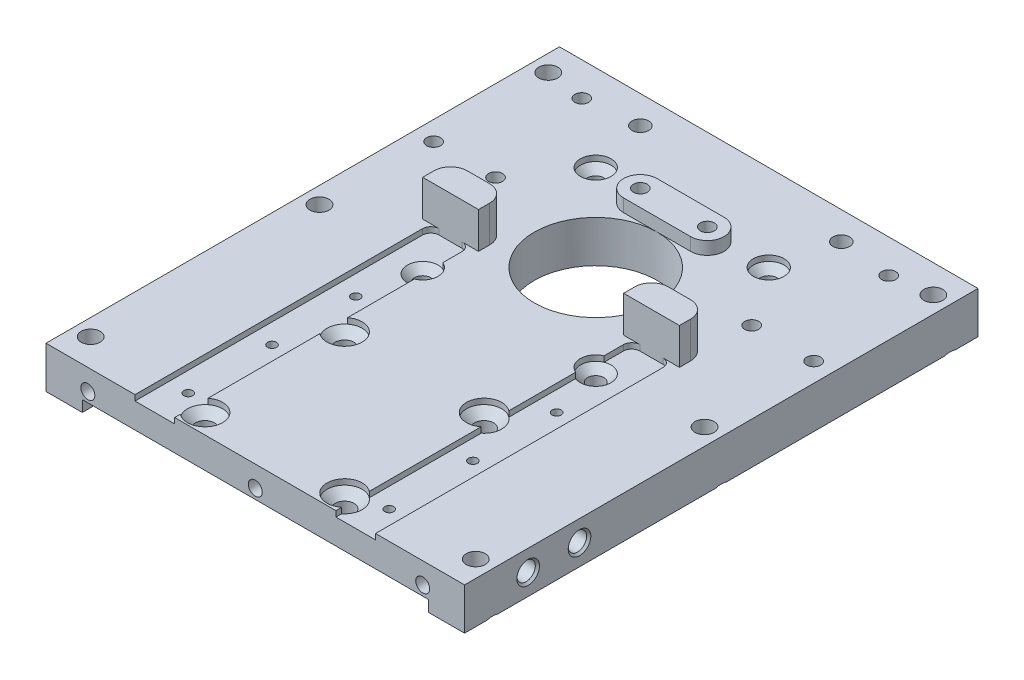
from build123d import *

# Parameters (mm, degrees)
SKETCH_1_W                   = 75
SKETCH_1_H                   = 92
EXTRUDE_1488_DEPTH           = 7.5
SKETCH_16_W                  = 7.1
SKETCH_16_H                  = 53
CUT_EXTRUDE_2987_DEPTH       = 1
HOLE_WIZARD_M3_D             = 1.6
HOLE_WIZARD_15_M3_AT_2_COUNT = 2
HOLE_WIZARD_15_M3_AT_2_PITCH = 25
HOLE_WIZARD_15_M3_AT_3_COUNT = 2
HOLE_WIZARD_15_M3_AT_3_PITCH = 35.355339059
HOLE_WIZARD_15_M3_AT_4_COUNT = 2
HOLE_WIZARD_15_M3_AT_4_PITCH = 25
SKETCH_28_R                  = 11
CUT_EXTRUDE_6514_DEPTH       = 81.64428064
HOLE_WIZARD_6682_AT_2_COUNT  = 2
HOLE_WIZARD_6682_AT_2_PITCH  = 31
HOLE_WIZARD_6682_AT_3_COUNT  = 2
HOLE_WIZARD_6682_AT_3_PITCH  = 43.840620434
HOLE_WIZARD_6682_AT_4_COUNT  = 2
HOLE_WIZARD_6682_AT_4_PITCH  = 31
SKETCH_90_W                  = 10
SKETCH_90_H                  = 5
EXTRUDE_8536_DEPTH           = 6.5
EXTRUDE_9344_DEPTH           = 2.3
HOLE_WIZARD_M3_2_D           = 2.5
SKETCH_77_W                  = 62
SKETCH_77_H                  = 34
CUT_EXTRUDE_1_DEPTH          = 2
HOLE_WIZARD_M3_3_D           = 2.5
HOLE_WIZARD_M3_3_DEPTH       = 5
HOLE_WIZARD_M3_3_CSINK_D     = 3.05
HOLE_WIZARD_M3_3_CSINK_ANGLE = 90
HOLE_WIZARD_M3_3_TIP         = 0.751075774
HOLE_WIZARD_M3_4_D           = 2.5
HOLE_WIZARD_M3_4_DEPTH       = 5
HOLE_WIZARD_M3_4_TIP         = 0.751075774
HOLE_WIZARD_M3_5_D           = 3.4
HOLE_WIZARD_M3_5_CSINK_D     = 6.3
HOLE_WIZARD_M3_5_CSINK_ANGLE = 90
SKETCH_63_R                  = 1.495
CUT_EXTRUDE_15431_DEPTH      = 81.64428064
FILLET_2_R                   = 1.5
PATTERN_LINEAR_2_COUNT       = 3
PATTERN_LINEAR_2_PITCH       = 15
HOLE_WIZARD_1_M4_D           = 3.3
HOLE_WIZARD_1_M4_DEPTH       = 16
HOLE_WIZARD_1_M4_CSINK_D     = 4.05
HOLE_WIZARD_1_M4_CSINK_ANGLE = 90
HOLE_WIZARD_1_M4_TIP         = 0.991420021
HOLE_WIZARD_2_3_D            = 3.3
HOLE_WIZARD_2_3_DEPTH        = 16
HOLE_WIZARD_2_3_CSINK_D      = 4.05
HOLE_WIZARD_2_3_CSINK_ANGLE  = 90
HOLE_WIZARD_2_3_TIP          = 0.991420021
HOLE_WIZARD_M3_6_D           = 2.5
HOLE_WIZARD_3_D              = 2.5
FILLET_3_R                   = 3


with BuildPart() as part:
    # Эскиз1 → Extrude 1488 (new body)
    with BuildSketch(Plane(origin=(0, 0, 0), x_dir=(1, 0, 0), z_dir=(0, 1, 0))):
        with Locations((0, 25)):
            Rectangle(SKETCH_1_W, SKETCH_1_H)
    extrude(amount=EXTRUDE_1488_DEPTH)

    # Эскиз16 → Cut-Extrude 2987 (cut)
    with BuildSketch(Plane(origin=(0, 7.5, 0), x_dir=(1, 0, 0), z_dir=(0, 1, 0))):
        with Locations((-18, 5.5)):
            Rectangle(SKETCH_16_W, SKETCH_16_H)
        with Locations((18, 5.5)):
            Rectangle(SKETCH_16_W, SKETCH_16_H)
    extrude(amount=-CUT_EXTRUDE_2987_DEPTH, mode=Mode.SUBTRACT)

    # Hole Wizard M3 (through all)
    with Locations(Plane(origin=(0, 6.5, 0), x_dir=(1, 0, 0), z_dir=(0, 1, 0))):
        with Locations((-18, -15), (18, -15)):
            hole_wizard_m3 = Hole(HOLE_WIZARD_M3_D / 2)

    # Эскиз56 → Каретка 15 - M3 (revolve, cut)
    with BuildSketch(Plane(origin=(-12.5, 7.5, -7.5), x_dir=(0, 0, 1), z_dir=(1, 0, 0))):
        Polygon((0, 0), (0, 7.5), (1.7, 7.5), (1.7, 2.45), (3.15, 1), (3.15, 0), align=None)
    hole_wizard_15_m3 = revolve(axis=Axis((-12.5, 13.85, -7.5), (0, -1, 0)), mode=Mode.SUBTRACT)

    # Каретка 15 - M3 at 2: Каретка 15 - M3 ×2
    with Locations(*[(0, 0, i * HOLE_WIZARD_15_M3_AT_2_PITCH) for i in range(1, HOLE_WIZARD_15_M3_AT_2_COUNT)]):
        add(hole_wizard_15_m3, mode=Mode.SUBTRACT)

    # Каретка 15 - M3 at 3: Каретка 15 - M3 ×2
    with Locations(*[Vector(0.7071067811865475, 0, 0.7071067811865476) * (i * HOLE_WIZARD_15_M3_AT_3_PITCH) for i in range(1, HOLE_WIZARD_15_M3_AT_3_COUNT)]):
        add(hole_wizard_15_m3, mode=Mode.SUBTRACT)

    # Каретка 15 - M3 at 4: Каретка 15 - M3 ×2
    with Locations(*[(i * HOLE_WIZARD_15_M3_AT_4_PITCH, 0, 0) for i in range(1, HOLE_WIZARD_15_M3_AT_4_COUNT)]):
        add(hole_wizard_15_m3, mode=Mode.SUBTRACT)

    # Эскиз28 → Cut-Extrude 6514 (cut, through all)
    with BuildSketch(Plane(origin=(0, 7.5, 0), x_dir=(1, 0, 0), z_dir=(0, 1, 0))):
        with Locations(Location((0, 40, 0), (0, 0, 270))):
            Circle(SKETCH_28_R)
    extrude(amount=-CUT_EXTRUDE_6514_DEPTH, mode=Mode.SUBTRACT)

    # Эскиз31 → Hole Wizard 6682 (revolve, cut)
    with BuildSketch(Plane(origin=(-15.5, 7.5, -55.5), x_dir=(0, 0, 1), z_dir=(1, 0, 0))):
        Polygon((0, 0), (0, 7.5), (1.45, 7.5), (1.45, 2.3), (2.75, 1), (2.75, 0), align=None)
    hole_wizard_6682 = revolve(axis=Axis((-15.5, 13.85, -55.5), (0, -1, 0)), mode=Mode.SUBTRACT)

    # Hole Wizard 6682 at 2: Hole Wizard 6682 ×2
    with Locations(*[(i * HOLE_WIZARD_6682_AT_2_PITCH, 0, 0) for i in range(1, HOLE_WIZARD_6682_AT_2_COUNT)]):
        add(hole_wizard_6682, mode=Mode.SUBTRACT)

    # Hole Wizard 6682 at 3: Hole Wizard 6682 ×2
    with Locations(*[Vector(0.7071067811865476, 0, 0.7071067811865476) * (i * HOLE_WIZARD_6682_AT_3_PITCH) for i in range(1, HOLE_WIZARD_6682_AT_3_COUNT)]):
        add(hole_wizard_6682, mode=Mode.SUBTRACT)

    # Hole Wizard 6682 at 4: Hole Wizard 6682 ×2
    with Locations(*[(0, 0, i * HOLE_WIZARD_6682_AT_4_PITCH) for i in range(1, HOLE_WIZARD_6682_AT_4_COUNT)]):
        add(hole_wizard_6682, mode=Mode.SUBTRACT)

    # Эскиз90 → Extrude 8536 (add)
    with BuildSketch(Plane(origin=(0, 7.5, 0), x_dir=(1, 0, 0), z_dir=(0, 1, 0))):
        with Locations((18, 34.5)):
            Rectangle(SKETCH_90_W, SKETCH_90_H)
        with Locations((-18, 34.5)):
            Rectangle(SKETCH_90_W, SKETCH_90_H)
    extrude(amount=EXTRUDE_8536_DEPTH)

    # Эскиз87 → Extrude 9344 (add)
    with BuildSketch(Plane(origin=(0, 7.5, 0), x_dir=(1, 0, 0), z_dir=(0, 1, 0))):
        with BuildLine():
            Line((-6, 57), (6, 57))
            ThreePointArc((6, 57), (9, 54), (6, 51))
            Line((6, 51), (-6, 51))
            ThreePointArc((-6, 51), (-9, 54), (-6, 57))
        make_face()
    extrude(amount=EXTRUDE_9344_DEPTH)

    # Hole Wizard M3 2 (through all)
    with Locations(Plane(origin=(0, 9.8, 0), x_dir=(-1, 0, 0), z_dir=(0, 1, 0))):
        with Locations((6, -54), (-6, -54)):
            Hole(HOLE_WIZARD_M3_2_D / 2)

    # Эскиз77 → Вырез-Вытянуть1 (cut)
    with BuildSketch(Plane.XZ):
        with Locations((0, 5)):
            Rectangle(SKETCH_77_W, SKETCH_77_H)
    extrude(amount=-CUT_EXTRUDE_1_DEPTH, mode=Mode.SUBTRACT)

    # Hole Wizard M3 3
    with Locations(Plane(origin=(0, 0, -71), x_dir=(-1, 0, 0), z_dir=(0, 0, -1))):
        with Locations((-30, 3.75), (0, 3.75), (30, 3.75)):
            CounterSinkHole(HOLE_WIZARD_M3_3_D / 2, HOLE_WIZARD_M3_3_CSINK_D / 2, depth=HOLE_WIZARD_M3_3_DEPTH, counter_sink_angle=HOLE_WIZARD_M3_3_CSINK_ANGLE)
            with Locations((0, 0, -(HOLE_WIZARD_M3_3_DEPTH + HOLE_WIZARD_M3_3_TIP / 2))):  # 118° drill point
                Cone(0, HOLE_WIZARD_M3_3_D / 2, HOLE_WIZARD_M3_3_TIP, mode=Mode.SUBTRACT)

    # Hole Wizard M3 4
    with Locations(Plane.XY.offset(21)):
        with Locations((-30, 3.75), (0, 3.75), (30, 3.75)):
            Hole(HOLE_WIZARD_M3_4_D / 2, depth=HOLE_WIZARD_M3_4_DEPTH)
            with Locations((0, 0, -(HOLE_WIZARD_M3_4_DEPTH + HOLE_WIZARD_M3_4_TIP / 2))):  # 118° drill point
                Cone(0, HOLE_WIZARD_M3_4_D / 2, HOLE_WIZARD_M3_4_TIP, mode=Mode.SUBTRACT)

    # Hole Wizard M3 5 (through all)
    with Locations(Plane(origin=(0, 0, 0), x_dir=(-1, 0, 0), z_dir=(0, -1, 0))):
        with Locations((34.5, 25), (34.5, -16), (34.5, 66), (-34.5, 66), (-34.5, 25), (-34.5, -16)):
            CounterSinkHole(HOLE_WIZARD_M3_5_D / 2, HOLE_WIZARD_M3_5_CSINK_D / 2, counter_sink_angle=HOLE_WIZARD_M3_5_CSINK_ANGLE)

    # Эскиз63 → Cut-Extrude 15431 (cut, through all)
    with BuildSketch(Plane(origin=(0, 7.5, 0), x_dir=(1, 0, 0), z_dir=(0, 1, 0))):
        with Locations(Location((-18, 66, 0), (0, 0, 270))):
            Circle(SKETCH_63_R)
        with Locations(Location((18, 66, 0), (0, 0, 270))):
            Circle(SKETCH_63_R)
    extrude(amount=-CUT_EXTRUDE_15431_DEPTH, mode=Mode.SUBTRACT)

    # Скругление2
    fillet_2_edges = [part.edges().sort_by_distance(p)[0] for p in [
        (-21.55, 7, -32),
        (-14.45, 7, -32),
        (-31, 1, -12),
        (31, 1, -12),
        (21.55, 7, -32),
        (14.45, 7, -32),
    ]]
    fillet(fillet_2_edges, radius=FILLET_2_R)

    # Линейный массив2: Hole Wizard M3 ×3
    with Locations(*[(0, 0, -i * PATTERN_LINEAR_2_PITCH) for i in range(1, PATTERN_LINEAR_2_COUNT)]):
        add(hole_wizard_m3, mode=Mode.SUBTRACT)

    # Трос1-M4
    with Locations(Plane.ZY.offset(37.5)):
        with Locations((0.4, 3.75), (9.6, 3.75)):
            CounterSinkHole(HOLE_WIZARD_1_M4_D / 2, HOLE_WIZARD_1_M4_CSINK_D / 2, depth=HOLE_WIZARD_1_M4_DEPTH, counter_sink_angle=HOLE_WIZARD_1_M4_CSINK_ANGLE)
            with Locations((0, 0, -(HOLE_WIZARD_1_M4_DEPTH + HOLE_WIZARD_1_M4_TIP / 2))):  # 118° drill point
                Cone(0, HOLE_WIZARD_1_M4_D / 2, HOLE_WIZARD_1_M4_TIP, mode=Mode.SUBTRACT)

    # Трос2-М3
    with Locations(Plane(origin=(37.5, 0, 0), x_dir=(0, 0, -1), z_dir=(1, 0, 0))):
        with Locations((-0.4, 3.75), (-9.6, 3.75)):
            CounterSinkHole(HOLE_WIZARD_2_3_D / 2, HOLE_WIZARD_2_3_CSINK_D / 2, depth=HOLE_WIZARD_2_3_DEPTH, counter_sink_angle=HOLE_WIZARD_2_3_CSINK_ANGLE)
            with Locations((0, 0, -(HOLE_WIZARD_2_3_DEPTH + HOLE_WIZARD_2_3_TIP / 2))):  # 118° drill point
                Cone(0, HOLE_WIZARD_2_3_D / 2, HOLE_WIZARD_2_3_TIP, mode=Mode.SUBTRACT)

    # Hole Wizard M3 6 (through all)
    with Locations(Plane(origin=(0, 0, 0), x_dir=(-1, 0, 0), z_dir=(0, -1, 0))):
        with Locations((34.05, 45), (22.95, 45), (-34.05, 45), (-22.95, 45)):
            Hole(HOLE_WIZARD_M3_6_D / 2)

    # Пружина-М3 (through all)
    with Locations(Plane(origin=(0, 7.5, 0), x_dir=(1, 0, 0), z_dir=(0, 1, 0))):
        with Locations((-27.5, 65), (27.5, 65)):
            Hole(HOLE_WIZARD_3_D / 2)

    # Скругление3
    fillet_3_edges = [part.edges().sort_by_distance(p)[0] for p in [
        (23, 10.75, -37),
        (13, 10.75, -37),
        (-23, 10.75, -37),
        (-13, 10.75, -37),
    ]]
    fillet(fillet_3_edges, radius=FILLET_3_R)


solid = part.part
